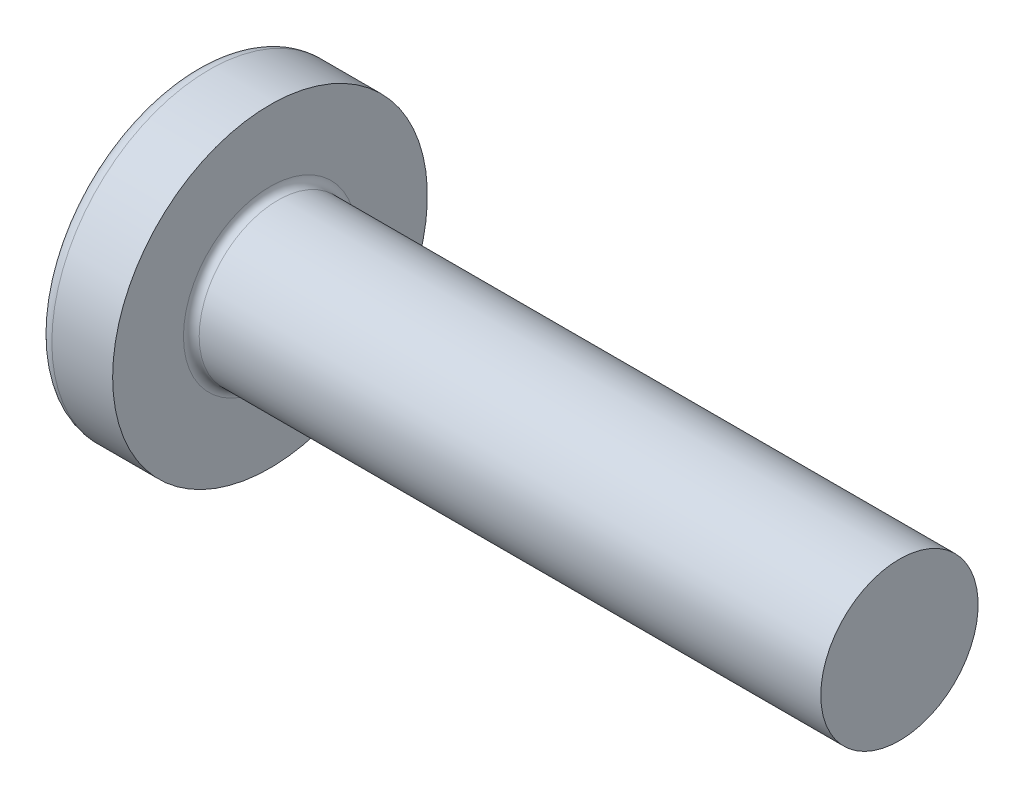
from build123d import *

# Parameters (mm, degrees)
FILLET1_R    = 0.2
RECPAT_COUNT = 2
RECPAT_ANGLE = 90


with BuildPart() as part:
    # BodySke → Base-Revolve (revolve)
    with BuildSketch(Plane.XY, mode=Mode.PRIVATE) as base_revolve_sk:
        with BuildLine():
            Line((3.1, 2), (3.1, 4))
            Line((3.1, 4), (1.555305874, 4))
            ThreePointArc((1.555305874, 4), (1.392873227, 3.961271902), (1.265388955, 3.853420195))
            ThreePointArc((1.265388955, 3.853420195), (0.324444487, 2.027933456), (0, 0))
            Line((0, 0), (19.1, 0))
            Line((19.1, 0), (19.1, 2))
            Line((19.1, 2), (3.1, 2))
        make_face()
    revolve(base_revolve_sk.sketch.rotate(Axis((1.555305874, 0, 0), (1, 0, 0)), 90), axis=Axis((1.555305874, 0, 0), (1, 0, 0)))

    # Fillet1
    fillet1_edges = [part.edges().sort_by_distance(p)[0] for p in [
        (3.1, 0, -2),
    ]]
    fillet(fillet1_edges, radius=FILLET1_R)

    # Sketch3 → Recess section 0
    with BuildSketch(Plane(origin=(0, 0, 0), x_dir=(0, 0, -1), z_dir=(1, 0, 0))):
        with BuildLine():
            Line((0.515, -2.15), (-0.515, -2.15))
            Line((-0.515, -2.15), (-0.515, 2.15))
            Line((-0.515, 2.15), (0.515, 2.15))
            Line((0.515, 2.15), (0.515, -2.15))
        make_face()
    # Sketch4 → Recess section 1
    with BuildSketch(Plane(origin=(2.34, 0, 0), x_dir=(0, 0, -1), z_dir=(1, 0, 0))):
        with BuildLine():
            Line((0.515, -0.983319232), (-0.515, -0.983319232))
            Line((-0.515, -0.983319232), (-0.515, 0.983319232))
            Line((-0.515, 0.983319232), (0.515, 0.983319232))
            Line((0.515, 0.983319232), (0.515, -0.983319232))
        make_face()
    recess = loft(mode=Mode.SUBTRACT)

    # RecPat: Recess ×2 about axis
    recpat_axis = Axis((0, 0, 0), (1, 0, 0))
    for i in range(1, RECPAT_COUNT):
        add(recess.rotate(recpat_axis, i * RECPAT_ANGLE / (RECPAT_COUNT - 1)), mode=Mode.SUBTRACT)

    # RecCorSke → RecessCore (revolve, cut)
    with BuildSketch(Plane.XY, mode=Mode.PRIVATE) as recesscore_sk:
        Polygon((0, 0), (0, 1.01462874), (2.34, 0.851), (2.616506661, 0), align=None)
    revolve(recesscore_sk.sketch.rotate(Axis((-3.175, 0, 0), (1, 0, 0)), 345.452408241), axis=Axis((-3.175, 0, 0), (1, 0, 0)), mode=Mode.SUBTRACT)


solid = part.part
